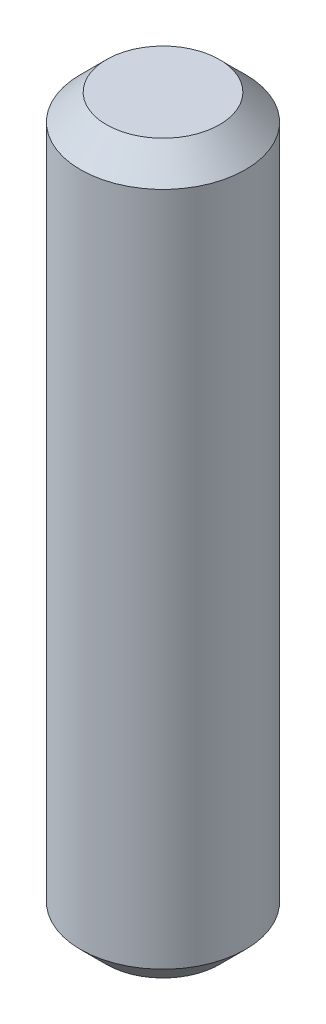
from build123d import *

# Parameters (mm, degrees)
SKETCH_1_R      = 1.5875
EXTRUDE_1_DEPTH = 14
CHAMFER_1_SIZE  = 0.5


with BuildPart() as part:
    # Эскиз1 → Бобышка-Вытянуть1 (new body)
    with BuildSketch(Plane(origin=(0, 0, 0), x_dir=(1, 0, 0), z_dir=(0, 1, 0))):
        with Locations(Location((0, 0, 0), (0, 0, 270))):
            Circle(SKETCH_1_R)
    extrude(amount=EXTRUDE_1_DEPTH)

    # Фаска1
    chamfer_1_edges = [part.edges().sort_by_distance(p)[0] for p in [
        (0, 0, -1.5875),
        (0, 14, -1.5875),
    ]]
    chamfer(chamfer_1_edges, length=CHAMFER_1_SIZE)


solid = part.part
